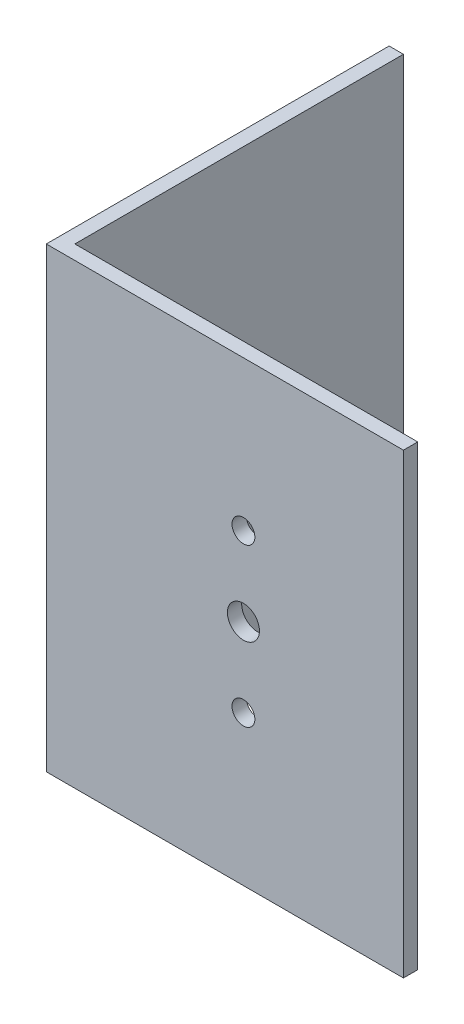
from build123d import *

# Parameters (mm, degrees)
SKETCH2_W           = 38.1
SKETCH2_H           = 50.8
BOSS_EXTRUDE1_DEPTH = 1.5875
SKETCH3_W           = 1.5875
SKETCH3_H           = 50.8
BOSS_EXTRUDE2_DEPTH = 38.1
CUT_EXTRUDE1_REACH  = 62.596
SKETCH4_R           = 1.778
SKETCH4_R_2         = 1.27


with BuildPart() as part:
    # Sketch2 → Boss-Extrude1 (new body)
    with BuildSketch(Plane(origin=(0, 0, 0), x_dir=(0, 0, -1), z_dir=(1, 0, 0))):
        Rectangle(SKETCH2_W, SKETCH2_H)
    extrude(amount=BOSS_EXTRUDE1_DEPTH)

    # Sketch3 → Boss-Extrude2 (add)
    with BuildSketch(Plane(origin=(1.5875, 0, 0), x_dir=(0, 0, -1), z_dir=(1, 0, 0))):
        with Locations((-18.25625, 0)):
            Rectangle(SKETCH3_W, SKETCH3_H)
    extrude(amount=BOSS_EXTRUDE2_DEPTH)

    # Sketch4 → Cut-Extrude1 (cut, up to next)
    with BuildSketch(Plane.XY.offset(19.05), mode=Mode.PRIVATE) as cut_extrude1_sk1:
        with Locations((21.9075, 0)):
            Circle(SKETCH4_R)
    cut_extrude1_tool1 = extrude(cut_extrude1_sk1.sketch, amount=-CUT_EXTRUDE1_REACH, mode=Mode.PRIVATE) & part.part
    # Sketch4 → Cut-Extrude1 (cut, up to next)
    with BuildSketch(Plane.XY.offset(19.05), mode=Mode.PRIVATE) as cut_extrude1_sk2:
        with Locations((21.9075, 8.763)):
            Circle(SKETCH4_R_2)
    cut_extrude1_tool2 = extrude(cut_extrude1_sk2.sketch, amount=-CUT_EXTRUDE1_REACH, mode=Mode.PRIVATE) & part.part
    # Sketch4 → Cut-Extrude1 (cut, up to next)
    with BuildSketch(Plane.XY.offset(19.05), mode=Mode.PRIVATE) as cut_extrude1_sk3:
        with Locations((21.9075, -8.763)):
            Circle(SKETCH4_R_2)
    cut_extrude1_tool3 = extrude(cut_extrude1_sk3.sketch, amount=-CUT_EXTRUDE1_REACH, mode=Mode.PRIVATE) & part.part
    add(cut_extrude1_tool1.solids().sort_by_distance((21.9075, 0, 19.05))[0], mode=Mode.SUBTRACT)
    add(cut_extrude1_tool2.solids().sort_by_distance((21.9075, 8.763, 19.05))[0], mode=Mode.SUBTRACT)
    add(cut_extrude1_tool3.solids().sort_by_distance((21.9075, -8.763, 19.05))[0], mode=Mode.SUBTRACT)


solid = part.part
